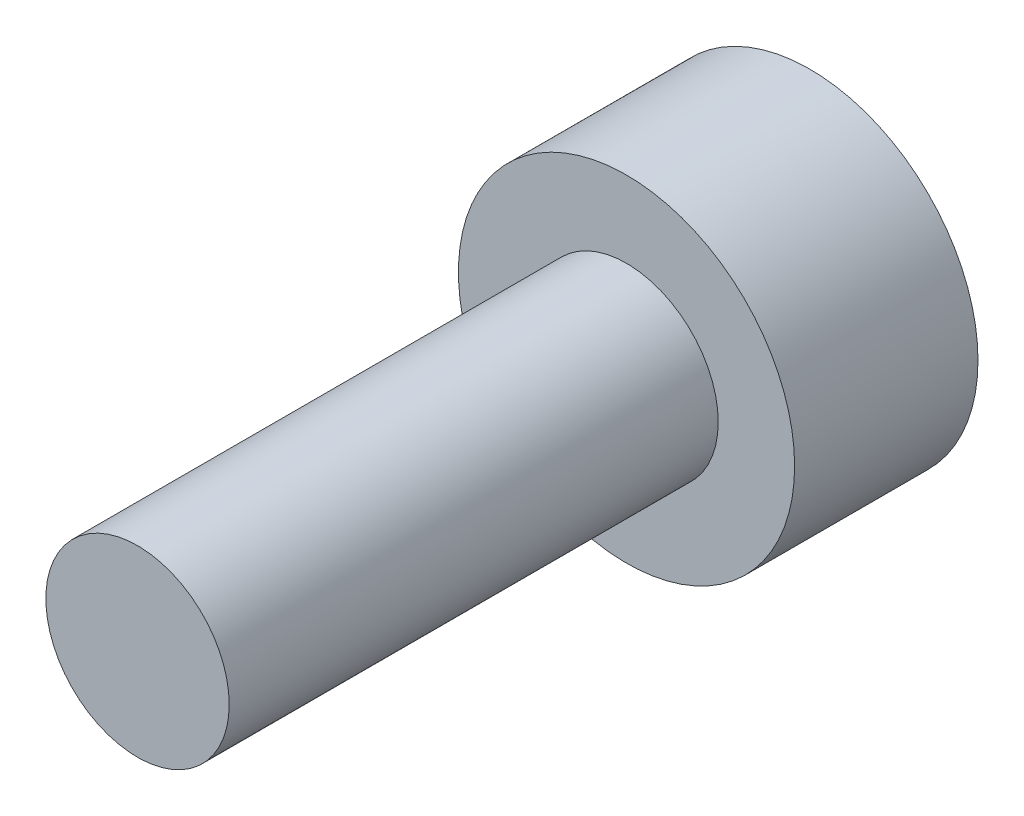
from build123d import *

# Parameters (mm, degrees)
CABEZA_START            = -3
CROQUIS1_R              = 2.75
CABEZA_DEPTH            = 3
CROQUIS2_R              = 1.5
CUERPO_DEPTH            = 8
HEXAGONO_INTERIOR_START = -3
HEXAGONO_INTERIOR_DEPTH = 1.3


with BuildPart() as part:
    # Croquis1 → Cabeza (new body)
    with BuildSketch(Plane.XY.offset(CABEZA_START)):
        Circle(CROQUIS1_R)
    extrude(amount=CABEZA_DEPTH)

    # Croquis2 → Cuerpo (add)
    with BuildSketch(Plane.XY):
        Circle(CROQUIS2_R)
    extrude(amount=CUERPO_DEPTH)

    # Croquis3 → Hexagono_interior (cut)
    with BuildSketch(Plane.XY.offset(HEXAGONO_INTERIOR_START)):
        Polygon((1.443375673, 0), (0.721687836, 1.25), (-0.721687836, 1.25), (-1.443375673, 0), (-0.721687836, -1.25), (0.721687836, -1.25), align=None)
    extrude(amount=HEXAGONO_INTERIOR_DEPTH, mode=Mode.SUBTRACT)


solid = part.part
